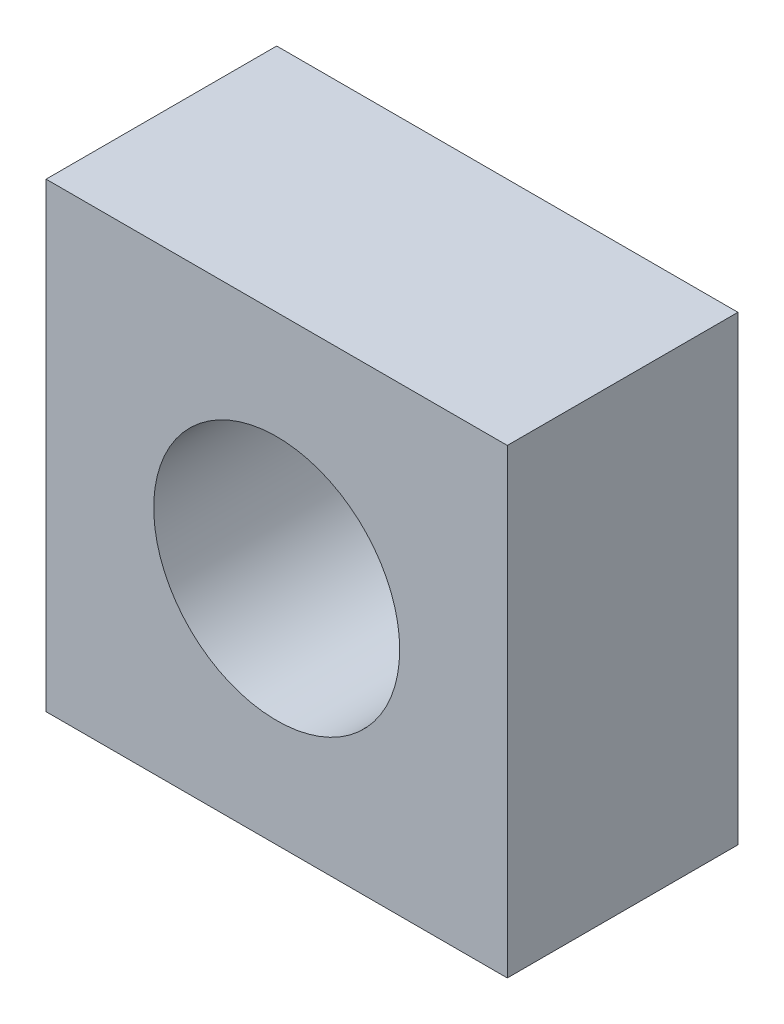
from build123d import *

# Parameters (mm, degrees)
SKETCH1_W           = 6
SKETCH1_H           = 6
SKETCH1_R           = 1.6
BOSS_EXTRUDE1_DEPTH = 3


with BuildPart() as part:
    # Sketch1 → Boss-Extrude1 (new body)
    with BuildSketch(Plane.XY):
        with Locations((3, 3)):
            Rectangle(SKETCH1_W, SKETCH1_H)
        with Locations((3, 3)):
            Circle(SKETCH1_R, mode=Mode.SUBTRACT)
    extrude(amount=BOSS_EXTRUDE1_DEPTH)


solid = part.part
